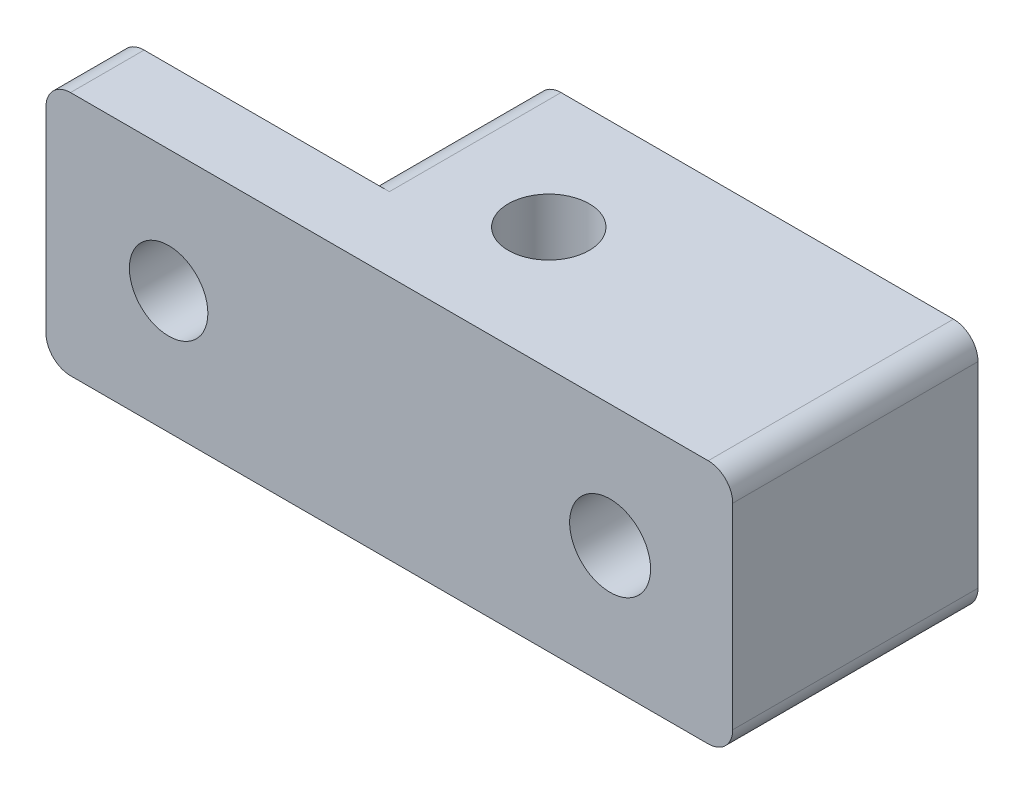
from build123d import *

# Parameters (mm, degrees)
SKETCH_1_W          = 28
SKETCH_1_H          = 10
SKETCH_1_R          = 1.65
SKETCH_1_R_2        = 1.6
EXTRUDE_1_DEPTH     = 10
SKETCH_2_R          = 1.65
CUT_EXTRUDE_1_DEPTH = 28
SKETCH_3_W          = 10
SKETCH_3_H          = 10
SKETCH_3_R          = 1.6
CUT_EXTRUDE_2_DEPTH = 7
FILLET_1_R          = 1


with BuildPart() as part:
    # ｽｹｯﾁ1 → ﾎﾞｽ - 押し出し1 (new body)
    with BuildSketch(Plane.XY):
        with Locations((-9, 0)):
            Rectangle(SKETCH_1_W, SKETCH_1_H)
        Circle(SKETCH_1_R, mode=Mode.SUBTRACT)
        with Locations((-18, 0)):
            Circle(SKETCH_1_R_2, mode=Mode.SUBTRACT)
    extrude(amount=EXTRUDE_1_DEPTH)

    # ｽｹｯﾁ2 → ｶｯﾄ - 押し出し1 (cut, through all)
    with BuildSketch(Plane(origin=(0, 5, 0), x_dir=(1, 0, 0), z_dir=(0, 1, 0))):
        with Locations(Location((-7.5, -5, 0), (0, 0, 270))):
            Circle(SKETCH_2_R)
    extrude(amount=-CUT_EXTRUDE_1_DEPTH, mode=Mode.SUBTRACT)

    # ｽｹｯﾁ3 → ｶｯﾄ - 押し出し2 (cut)
    with BuildSketch(Plane(origin=(0, 0, 0), x_dir=(-1, 0, 0), z_dir=(0, 0, -1))):
        with Locations((18, 0)):
            Rectangle(SKETCH_3_W, SKETCH_3_H)
        with Locations((18, 0)):
            Circle(SKETCH_3_R, mode=Mode.SUBTRACT)
    extrude(amount=-CUT_EXTRUDE_2_DEPTH, mode=Mode.SUBTRACT)

    # ﾌｨﾚｯﾄ1
    fillet_1_edges = [part.edges().sort_by_distance(p)[0] for p in [
        (-13, -5, 3.5),
        (-13, 5, 3.5),
        (5, -5, 5),
        (-23, -5, 8.5),
        (-23, 5, 8.5),
        (5, 5, 5),
    ]]
    fillet(fillet_1_edges, radius=FILLET_1_R)


solid = part.part
